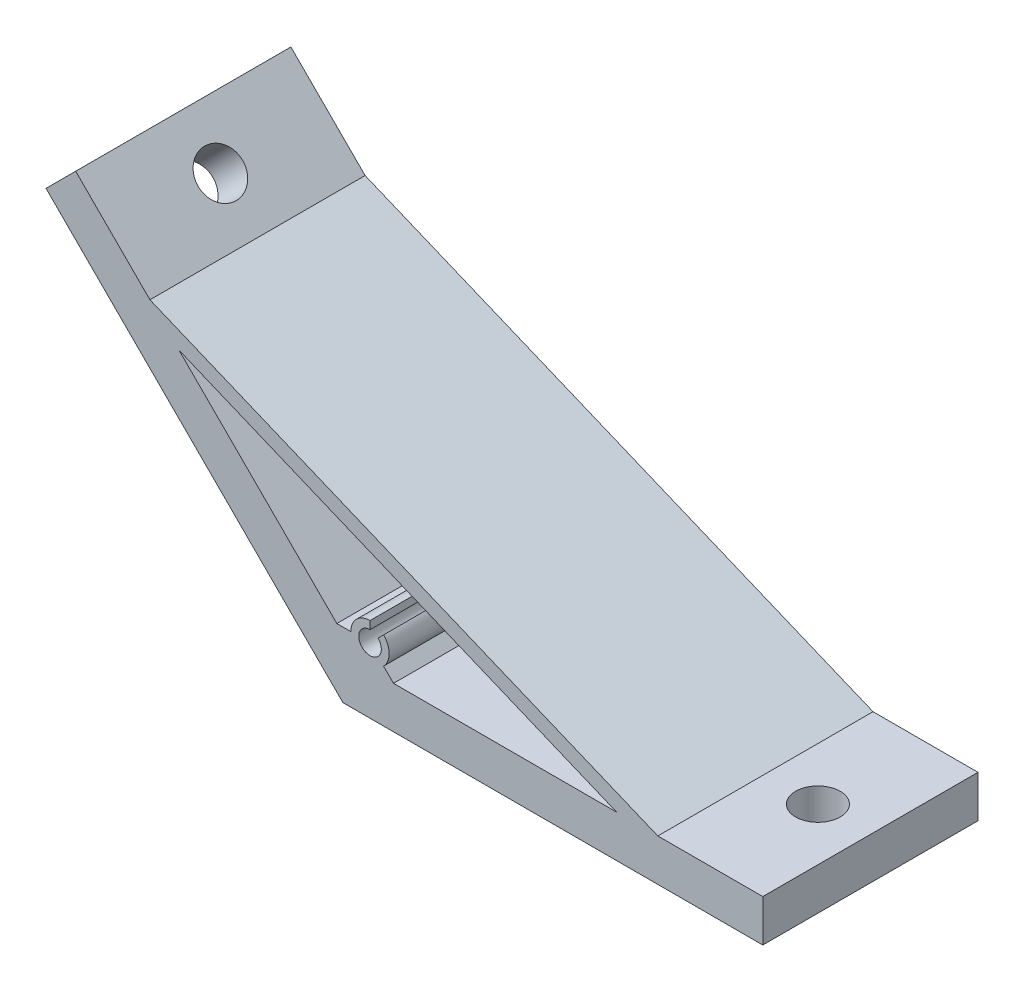
from build123d import *

# Parameters (mm, degrees)
EXTRUDE_1_DEPTH     = 20.5
SKETCH_3_R          = 4.25
CUT_EXTRUDE_1_DEPTH = 99.795969817


with BuildPart() as part:
    # 草图1 → 凸台-拉伸1 (new, symmetric)
    with BuildSketch(Plane.XY):
        Polygon((80, 0), (0, 0), (-56.568542495, 56.568542495), (-50.911688245, 62.225396744), (-36.769552622, 48.083261121), (60, 8), (80, 8), align=None)
        with BuildLine():
            Line((52.160622211, 8), (9.638600026, 8))
            Line((9.638600026, 8), (7.747166088, 9.891433938))
            ThreePointArc((7.747166088, 9.891433938), (8.816226337, 12.472373689), (7.747166088, 15.05331344))
            Line((7.747166088, 15.05331344), (6.686505916, 13.992653268))
            ThreePointArc((6.686505916, 13.992653268), (4.343456957, 10.486032694), (5.166226337, 14.622373689))
            Line((5.166226337, 14.622373689), (5.166226337, 16.122373689))
            ThreePointArc((5.166226337, 16.122373689), (2.585286586, 15.05331344), (1.516226337, 12.472373689))
            Line((1.516226337, 12.472373689), (-1.15866519, 12.472373689))
            Line((-1.15866519, 12.472373689), (-31.226275427, 42.539983926))
            Line((-31.226275427, 42.539983926), (52.160622211, 8))
        make_face(mode=Mode.SUBTRACT)
    extrude(amount=EXTRUDE_1_DEPTH, both=True)

    # 草图3 → 切除-拉伸1 (cut, through all)
    with BuildSketch(Plane(origin=(0, 8, 0), x_dir=(1, 0, 0), z_dir=(0, 1, 0))):
        with Locations(Location((70, 0, 0), (0, 0, 180))):
            Circle(SKETCH_3_R)
    cut_extrude_1 = extrude(amount=-CUT_EXTRUDE_1_DEPTH, mode=Mode.SUBTRACT)

    # 镜向1: 切除-拉伸1 across plane
    add(cut_extrude_1.mirror(Plane(origin=(0, 0, 0), x_dir=(0, 0, 1), z_dir=(-0.9238795325112867, 0.3826834323650898, 0))), mode=Mode.SUBTRACT)


solid = part.part
